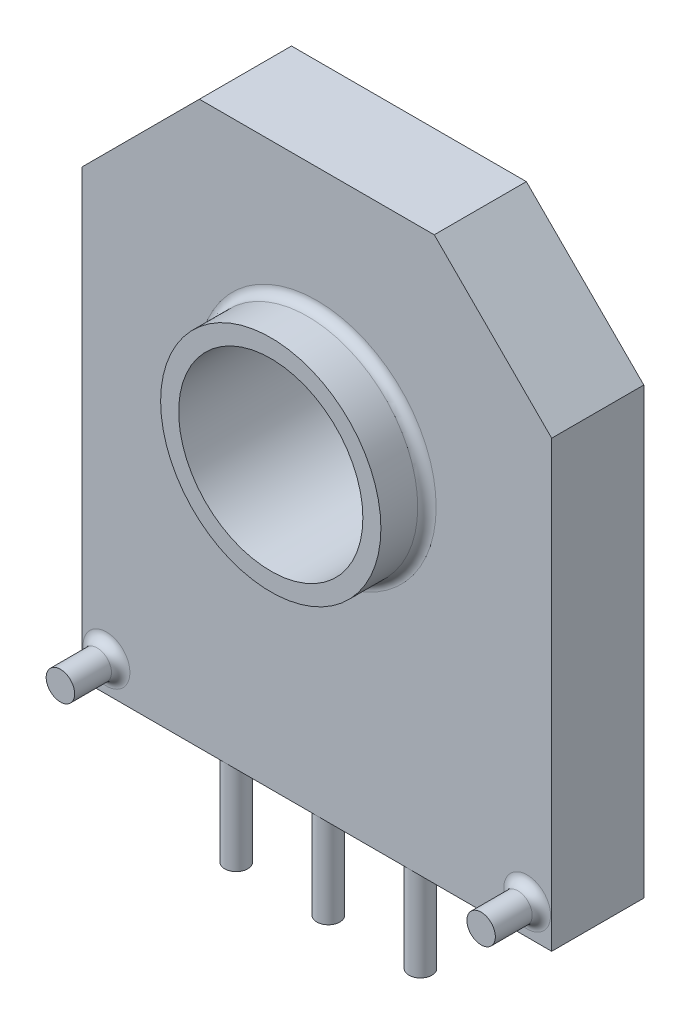
from build123d import *

# Parameters (mm, degrees)
SKETCH1_R           = 2
BOSS_EXTRUDE1_DEPTH = 2
SKETCH2_R           = 2.391473365
SKETCH2_R_2         = 2
SKETCH2_R_3         = 0.308853545
BOSS_EXTRUDE2_DEPTH = 1
FILLET1_R           = 0.2
SKETCH3_R           = 0.25
BOSS_EXTRUDE3_DEPTH = 2


with BuildPart() as part:
    # Sketch1 → Boss-Extrude1 (new body)
    with BuildSketch(Plane.XY):
        Polygon((0, -7.1), (5.1, -7.1), (5.1, 0), (5.1, 2.55), (2.55, 5.1), (-2.55, 5.1), (-5.1, 2.55), (-5.1, 0), (-5.1, -7.1), align=None)
        Circle(SKETCH1_R, mode=Mode.SUBTRACT)
    extrude(amount=BOSS_EXTRUDE1_DEPTH)

    # Sketch2 → Boss-Extrude2 (add)
    # profile 1 of 3: a face of its own
    with BuildSketch(Plane.XY.offset(2)):
        Circle(SKETCH2_R)
        Circle(SKETCH2_R_2, mode=Mode.SUBTRACT)
    # profile 2 of 3: a face of its own
    with BuildSketch(Plane.XY.offset(2)):
        with Locations((-4.567781371, -6.437447931)):
            Circle(SKETCH2_R_3)
    # profile 3 of 3: a face of its own
    with BuildSketch(Plane.XY.offset(2)):
        with Locations(Location((4.567781371, -6.437447931, 0), (0, 0, 180))):
            Circle(SKETCH2_R_3)
    extrude(amount=BOSS_EXTRUDE2_DEPTH)

    # Fillet1
    fillet1_edges = [part.edges().sort_by_distance(p)[0] for p in [
        (-4.876634915, -6.437447931, 2),
        (4.876634915, -6.437447931, 2),
        (-2.391473365, 0, 2),
    ]]
    fillet(fillet1_edges, radius=FILLET1_R)

    # Sketch3 → Boss-Extrude3 (add)
    with BuildSketch(Plane.XZ.offset(7.1)):
        with Locations(Location((0, 1.75, 0), (0, 0, 90))):
            Circle(SKETCH3_R)
        with Locations(Location((2, 1.75, 0), (0, 0, 90))):
            Circle(SKETCH3_R)
        with Locations(Location((-2, 1.75, 0), (0, 0, 180))):
            Circle(SKETCH3_R)
    extrude(amount=BOSS_EXTRUDE3_DEPTH)


solid = part.part
